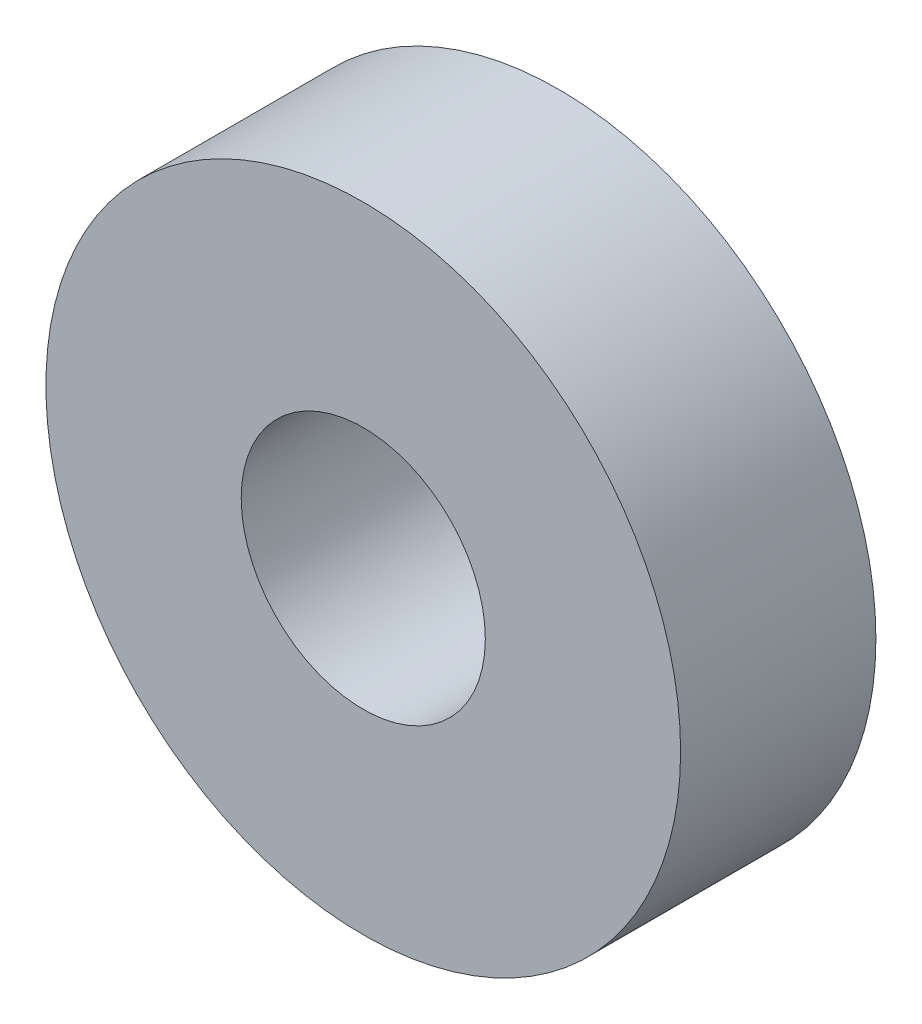
from build123d import *

# Parameters (mm, degrees)
SKETCH1_R           = 6.5
SKETCH1_R_2         = 2.5
BOSS_EXTRUDE1_DEPTH = 4


with BuildPart() as part:
    # Sketch1 → Boss-Extrude1 (new body)
    with BuildSketch(Plane.XY):
        Circle(SKETCH1_R)
        Circle(SKETCH1_R_2, mode=Mode.SUBTRACT)
    extrude(amount=BOSS_EXTRUDE1_DEPTH)


solid = part.part
